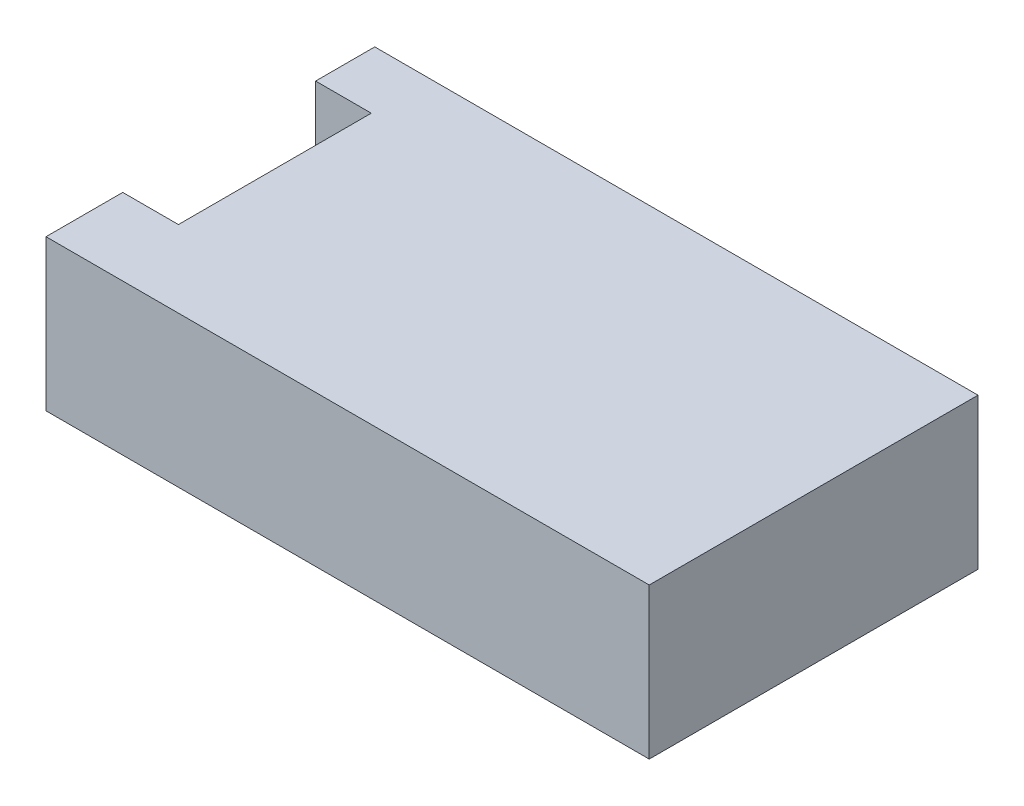
from build123d import *

# Parameters (mm, degrees)
SKETCH_1_W             = 200
SKETCH_1_H             = 109
EXTRUDE_1_DEPTH        = 50
SKETCH_2_W             = 18.460680343
SKETCH_2_H             = 63.94452195
CUT_EXTRUDE_1_DEPTH    = 34
SKETCH_3_W             = 20.806626264
SKETCH_3_H             = 5.638388786
EXTRUDE_2_DEPTH        = 5
PATTERN_LINEAR_1_COUNT = 5
PATTERN_LINEAR_1_PITCH = 10


with BuildPart() as part:
    # 草图1 → 凸台-拉伸1 (new body)
    with BuildSketch(Plane(origin=(0, 0, 0), x_dir=(1, 0, 0), z_dir=(0, 1, 0))):
        with Locations((94.587973274, -49.622494432)):
            Rectangle(SKETCH_1_W, SKETCH_1_H)
    extrude(amount=EXTRUDE_1_DEPTH)

    # 草图2 → 切除-拉伸1 (cut)
    with BuildSketch(Plane(origin=(0, 50, 0), x_dir=(1, 0, 0), z_dir=(0, 1, 0))):
        with Locations((3.818313446, -46.706785098)):
            Rectangle(SKETCH_2_W, SKETCH_2_H)
    extrude(amount=-CUT_EXTRUDE_1_DEPTH, mode=Mode.SUBTRACT)

    # 草图3 → 凸台-拉伸2 (add)
    with BuildSketch(Plane(origin=(0, 16, 0), x_dir=(1, 0, 0), z_dir=(0, 1, 0))):
        with Locations((4.991286406, -25.341462736)):
            Rectangle(SKETCH_3_W, SKETCH_3_H)
    extrude_2 = extrude(amount=EXTRUDE_2_DEPTH)

    # 阵列(线性)1: 凸台-拉伸2 ×5
    with Locations(*[(0, 0, i * PATTERN_LINEAR_1_PITCH) for i in range(1, PATTERN_LINEAR_1_COUNT)]):
        add(extrude_2)


solid = part.part
